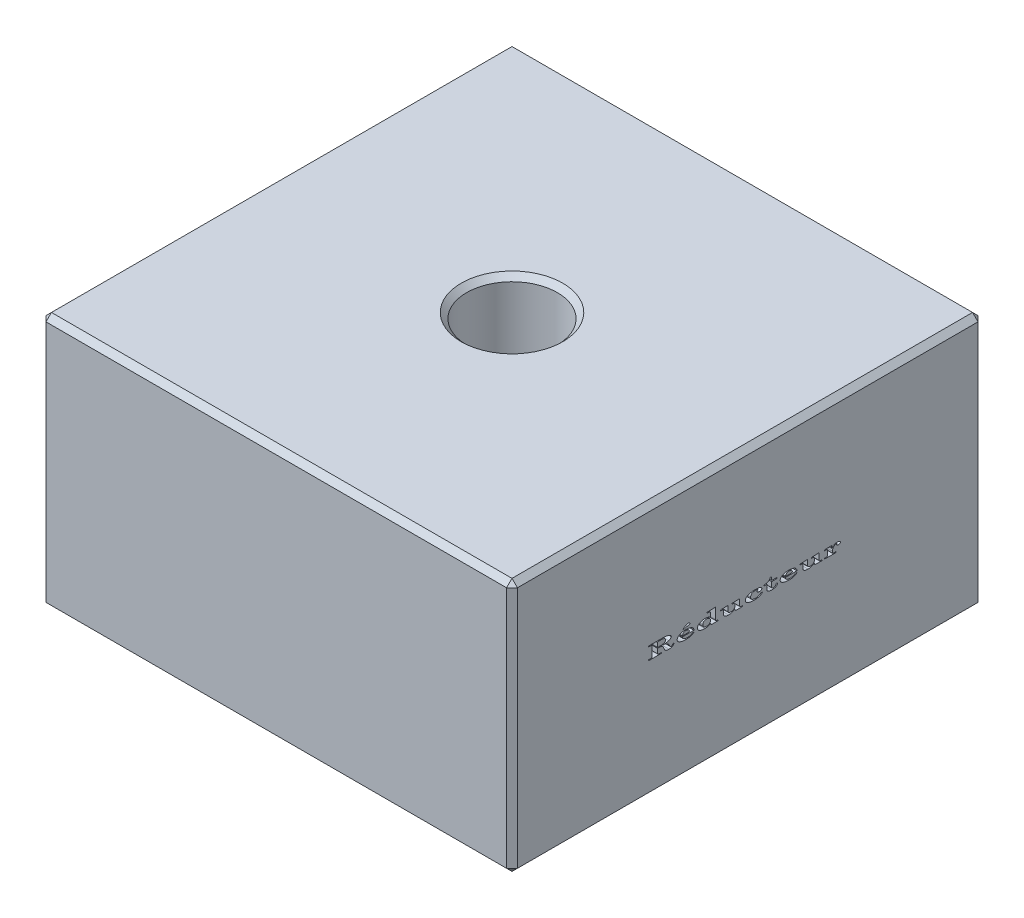
from build123d import *

# Parameters (mm, degrees)
ESQUISSE1_W             = 130
ESQUISSE1_H             = 130
ESQUISSE1_R             = 12.5
BOSS_EXTRU_1_DEPTH      = 70
CHANFREIN1_SIZE         = 1.5
ENL_V_MAT_EXTRU_1_DEPTH = 2


with BuildPart() as part:
    # Esquisse1 → Boss.-Extru.1 (new body)
    with BuildSketch(Plane(origin=(0, 0, 0), x_dir=(1, 0, 0), z_dir=(0, 1, 0))):
        with Locations((-65, 65)):
            Rectangle(ESQUISSE1_W, ESQUISSE1_H)
        with Locations(Location((-65, 65, 0), (0, 0, 270))):
            Circle(ESQUISSE1_R, mode=Mode.SUBTRACT)
    extrude(amount=BOSS_EXTRU_1_DEPTH)

    # Chanfrein1
    chanfrein1_edges = [part.edges().sort_by_distance(p)[0] for p in [
        (-65, 0, -77.5),
        (-65, 70, -77.5),
        (0, 70, -65),
        (-65, 70, -130),
        (-130, 70, -65),
        (-65, 0, -130),
        (0, 0, -65),
        (-65, 0, 0),
        (-130, 0, -65),
        (-130, 35, -130),
        (0, 35, -130),
        (0, 35, 0),
        (-130, 35, 0),
        (-65, 70, 0),
    ]]
    chamfer(chanfrein1_edges, length=CHANFREIN1_SIZE)

    # Esquisse2 → Enlèv. mat.-Extru.1 (cut)
    # profile 1 of 10: a face of its own
    with BuildSketch(Plane(origin=(0, 0, 0), x_dir=(0, 0, -1), z_dir=(1, 0, 0))):
        with BuildLine():
            Line((37.683124261, 36.492956048), (41.35069237, 36.492956048))
            add(Edge.make_bspline(
                [(41.35069237, 36.492956048), (41.423376937, 36.492435815), (41.565256509, 36.491420325), (41.773082977, 36.486903448), (41.970596284, 36.477647172), (42.157856433, 36.465226235), (42.334591198, 36.449114049), (42.501152908, 36.429904694), (42.657224341, 36.405741581), (42.803516838, 36.37961398), (42.939858773, 36.348907036), (43.067484737, 36.317150025), (43.186139016, 36.28221061), (43.295533585, 36.244291331), (43.396165879, 36.20463166), (43.487579822, 36.161944011), (43.570103325, 36.116333424), (43.643551913, 36.068079676), (43.708737596, 36.018206608), (43.76483423, 35.966547538), (43.812332924, 35.913358524), (43.852358591, 35.859469283), (43.882702299, 35.803189907), (43.903721884, 35.745488578), (43.918125516, 35.686903231), (43.919577487, 35.64701987), (43.920303748, 35.627070631)],
                knots=[0, 0, 0, 0, 1.803406573, 3.520232142, 5.157135887, 6.708840274, 8.176126967, 9.559920692, 10.867921294, 12.093964218, 13.246167546, 14.33467399, 15.356603101, 16.31382416, 17.206448863, 18.039109272, 18.815194361, 19.543727151, 20.217572676, 20.849472375, 21.432614653, 21.984688226, 22.511328061, 23.012182554, 23.505904074, 24, 24, 24, 24], degree=3))
            add(Edge.make_bspline(
                [(43.920303748, 35.627070631), (43.919796843, 35.611134682), (43.91879074, 35.579505038), (43.9096902, 35.532810344), (43.896714708, 35.487011854), (43.877296031, 35.442446597), (43.852794456, 35.398857026), (43.822298542, 35.356893953), (43.787115868, 35.31584528), (43.745910846, 35.276627016), (43.699737196, 35.237926299), (43.647475856, 35.201174406), (43.590586726, 35.164179447), (43.527531349, 35.12961104), (43.459283275, 35.096097118), (43.386116295, 35.062732998), (43.307138993, 35.031506487), (43.252202256, 35.012233542), (43.224089806, 35.002371112)],
                knots=[0, 0, 0, 0, 0.76683207, 1.522006948, 2.28436379, 3.055973676, 3.857471639, 4.688469069, 5.550530586, 6.458137834, 7.425299066, 8.449977353, 9.533564859, 10.692593611, 11.910952816, 13.195736886, 14.564991094, 16, 16, 16, 16], degree=3))
            add(Edge.make_bspline(
                [(43.224089806, 35.002371112), (43.177024725, 34.987388181), (43.077828063, 34.955809424), (42.918385194, 34.916375281), (42.741121029, 34.881844511), (42.546075385, 34.850502061), (42.333093671, 34.822568087), (42.102086059, 34.7990013), (41.853353582, 34.779344759), (41.681412694, 34.770145002), (41.592579389, 34.765391945)],
                knots=[0, 0, 0, 0, 0.716884242, 1.510940212, 2.382572195, 3.338025058, 4.378301861, 5.500451401, 6.708607549, 8, 8, 8, 8], degree=3))
            add(Edge.make_bspline(
                [(41.592579389, 34.765391945), (41.638173441, 34.761643497), (41.726647892, 34.754369701), (41.855165323, 34.740080182), (41.97577976, 34.724700974), (42.08834379, 34.70835106), (42.192544706, 34.689169405), (42.288646181, 34.668901864), (42.377013911, 34.647638067), (42.48286722, 34.615870265), (42.606417457, 34.570335231), (42.745596934, 34.50349081), (42.876522783, 34.425310101), (42.95593442, 34.363108505), (42.9955241, 34.332098676)],
                knots=[0, 0, 0, 0, 1.102707776, 2.139784928, 3.116648603, 4.03367121, 4.881196666, 5.670093997, 6.401088389, 7.071267056, 8.333281504, 9.570469844, 10.788788043, 12, 12, 12, 12], degree=3))
            add(Edge.make_bspline(
                [(42.9955241, 34.332098676), (43.042000135, 34.287617925), (43.135139791, 34.198476888), (43.258953608, 34.048735289), (43.370418804, 33.886743691), (43.432476241, 33.770445544), (43.463873459, 33.711605887)],
                knots=[0, 0, 0, 0, 0.986881488, 1.977746238, 2.976864887, 4, 4, 4, 4], degree=3))
            add(Edge.make_bspline(
                [(43.463873459, 33.711605887), (43.482008016, 33.675905189), (43.515702838, 33.609571685), (43.567024202, 33.520338019), (43.615527141, 33.448938689), (43.650232845, 33.410523702), (43.665796536, 33.393296593)],
                knots=[0, 0, 0, 0, 1.269850929, 2.359440203, 3.264294845, 4, 4, 4, 4], degree=3))
            add(Edge.make_bspline(
                [(43.665796536, 33.393296593), (43.680759229, 33.380045375), (43.709543376, 33.35455364), (43.7594763, 33.327335376), (43.811945141, 33.310431914), (43.848199337, 33.308182671), (43.86631737, 33.307058612)],
                knots=[0, 0, 0, 0, 1.069445198, 2.05732133, 3.029146416, 4, 4, 4, 4], degree=3))
            add(Edge.make_bspline(
                [(43.86631737, 33.307058612), (43.890765894, 33.308144762), (43.937895005, 33.31023852), (44.004794899, 33.329975005), (44.064267527, 33.361697551), (44.115130552, 33.407466992), (44.157576492, 33.465617631), (44.19169314, 33.536250195), (44.218362521, 33.619108144), (44.228861611, 33.679180045), (44.234406312, 33.710904766)],
                knots=[0, 0, 0, 0, 0.968222769, 1.866430792, 2.742136399, 3.622544868, 4.557498432, 5.582058266, 6.723054818, 8, 8, 8, 8], degree=3))
            Line((44.234406312, 33.710904766), (44.638252466, 33.710904766))
            add(Edge.make_bspline(
                [(44.638252466, 33.710904766), (44.633699157, 33.677788143), (44.624837974, 33.613339966), (44.598127728, 33.521489944), (44.563420492, 33.436711718), (44.518428773, 33.359458995), (44.465228361, 33.28856586), (44.401146794, 33.225998526), (44.328592202, 33.17013418), (44.246197721, 33.122556175), (44.155350596, 33.081381436), (44.055797632, 33.045838132), (43.947746199, 33.014672519), (43.830378409, 32.991009643), (43.704620744, 32.970819725), (43.569703542, 32.958376816), (43.426131829, 32.949501452), (43.32740372, 32.948565286), (43.27667394, 32.948084253)],
                knots=[0, 0, 0, 0, 0.925636545, 1.801378947, 2.643670301, 3.459376239, 4.273175777, 5.09327009, 5.934314528, 6.805515203, 7.724597842, 8.696083653, 9.733802265, 10.83933073, 12.013204389, 13.263280177, 14.593782513, 16, 16, 16, 16], degree=3))
            add(Edge.make_bspline(
                [(43.27667394, 32.948084253), (43.240213306, 32.948361355), (43.169369755, 32.94889977), (43.0657451, 32.952841615), (42.967847903, 32.96099971), (42.875112832, 32.970153748), (42.787931556, 32.983798774), (42.706207689, 32.999544509), (42.629943613, 33.018633487), (42.537676615, 33.046699122), (42.432595883, 33.089416455), (42.320452876, 33.152394518), (42.223358584, 33.225952762), (42.171743434, 33.285102191), (42.146465607, 33.31406983)],
                knots=[0, 0, 0, 0, 1.068954469, 2.076994353, 3.039189998, 3.948688258, 4.808215989, 5.625208688, 6.387967345, 7.111852932, 8.451655562, 9.703494892, 10.875317454, 12, 12, 12, 12], degree=3))
            add(Edge.make_bspline(
                [(42.146465607, 33.31406983), (42.138845412, 33.324017837), (42.121957073, 33.346065212), (42.097508348, 33.384948422), (42.072118768, 33.433002014), (42.043218069, 33.488910165), (42.01237657, 33.553685268), (41.979684575, 33.627202132), (41.944452156, 33.709406944), (41.921057517, 33.767414607), (41.908785318, 33.797843868)],
                knots=[0, 0, 0, 0, 0.55634834, 1.233012928, 2.036541127, 2.969605349, 4.028117026, 5.222172624, 6.542826454, 8, 8, 8, 8], degree=3))
            add(Edge.make_bspline(
                [(41.908785318, 33.797843868), (41.894512811, 33.833458489), (41.867042639, 33.902005644), (41.823911332, 33.99947251), (41.783002858, 34.088289015), (41.743116251, 34.167987158), (41.70381215, 34.23802672), (41.666231714, 34.299470862), (41.629156595, 34.351444005), (41.581486078, 34.408898568), (41.516186081, 34.469542594), (41.429767365, 34.532383596), (41.33226258, 34.584600127), (41.224167232, 34.626673949), (41.104136126, 34.658475548), (40.971992425, 34.682569599), (40.826259782, 34.695081819), (40.724844917, 34.697055789), (40.672006472, 34.698084253)],
                knots=[0, 0, 0, 0, 1.098647794, 2.114557956, 3.051761701, 3.898792814, 4.665848314, 5.351146269, 5.960320432, 6.492456216, 7.486662963, 8.502749468, 9.54484207, 10.64473262, 11.816932471, 13.095552934, 14.486745831, 16, 16, 16, 16], degree=3))
            Line((40.672006472, 34.698084253), (40.151072979, 34.698084253))
            Line((40.151072979, 34.698084253), (40.151072979, 33.406617907))
            add(Edge.make_bspline(
                [(40.151072979, 33.406617907), (40.152208336, 33.393029868), (40.1544617, 33.366061441), (40.175509595, 33.329451497), (40.207887324, 33.297935051), (40.236077805, 33.283838018), (40.251333395, 33.276209253)],
                knots=[0, 0, 0, 0, 0.928449039, 1.842709581, 2.832558461, 4, 4, 4, 4], degree=3))
            add(Edge.make_bspline(
                [(40.251333395, 33.276209253), (40.276156057, 33.266951457), (40.32682876, 33.248052696), (40.408458801, 33.230693971), (40.495443517, 33.218951341), (40.555576689, 33.217870365), (40.586469613, 33.217315022)],
                knots=[0, 0, 0, 0, 0.92754544, 1.893480841, 2.917793015, 4, 4, 4, 4], degree=3))
            Line((40.586469613, 33.217315022), (41.227996056, 33.217315022))
            Line((41.227996056, 33.217315022), (41.227996056, 32.992956048))
            Line((41.227996056, 32.992956048), (37.683124261, 32.992956048))
            Line((37.683124261, 32.992956048), (37.683124261, 33.217315022))
            Line((37.683124261, 33.217315022), (38.236309357, 33.217315022))
            add(Edge.make_bspline(
                [(38.236309357, 33.217315022), (38.270004683, 33.217855735), (38.333141525, 33.218868899), (38.421081585, 33.229564723), (38.496520726, 33.245091511), (38.558234409, 33.270026757), (38.608317611, 33.299448361), (38.644050255, 33.33677212), (38.666420379, 33.380388337), (38.668996424, 33.41174055), (38.670303748, 33.42765156)],
                knots=[0, 0, 0, 0, 1.519345433, 2.846883625, 3.992908673, 4.981747751, 5.839048337, 6.5924564, 7.285682287, 8, 8, 8, 8], degree=3))
            Line((38.670303748, 33.42765156), (38.670303748, 36.058260535))
            add(Edge.make_bspline(
                [(38.670303748, 36.058260535), (38.669238079, 36.075307677), (38.66717924, 36.108242226), (38.646854224, 36.153516014), (38.614761832, 36.191857), (38.568554898, 36.219946697), (38.512556942, 36.242111927), (38.445766954, 36.258056466), (38.368336036, 36.266459625), (38.313218995, 36.267856297), (38.283985639, 36.268597073)],
                knots=[0, 0, 0, 0, 0.827674399, 1.599041186, 2.376038156, 3.233440287, 4.205690717, 5.309551299, 6.573021251, 8, 8, 8, 8], degree=3))
            Line((38.283985639, 36.268597073), (37.683124261, 36.268597073))
            Line((37.683124261, 36.268597073), (37.683124261, 36.492956048))
        make_face()
        with BuildLine():
            Line((40.151072979, 34.922443227), (40.749830991, 34.922443227))
            add(Edge.make_bspline(
                [(40.749830991, 34.922443227), (40.814349724, 34.922814259), (40.939962032, 34.923536625), (41.123045887, 34.933948606), (41.295936067, 34.948906749), (41.458366549, 34.970324523), (41.610176631, 34.998486843), (41.751770873, 35.031753239), (41.882843991, 35.071836726), (41.965077379, 35.104882397), (42.004839004, 35.120860695)],
                knots=[0, 0, 0, 0, 1.210749494, 2.357222947, 3.440562319, 4.467231304, 5.430783553, 6.337223366, 7.196011459, 8, 8, 8, 8], degree=3))
            add(Edge.make_bspline(
                [(42.004839004, 35.120860695), (42.032098126, 35.133960026), (42.084861272, 35.159315279), (42.155537853, 35.2075951), (42.21603682, 35.261623658), (42.265271359, 35.322984982), (42.303615496, 35.390897751), (42.330129575, 35.465650182), (42.346737992, 35.546648977), (42.348751076, 35.602914642), (42.349790927, 35.631978484)],
                knots=[0, 0, 0, 0, 1.102952523, 2.134890675, 3.113590473, 4.054469501, 4.994380606, 5.947256615, 6.939662239, 8, 8, 8, 8], degree=3))
            add(Edge.make_bspline(
                [(42.349790927, 35.631978484), (42.348643753, 35.658689384), (42.346409849, 35.710703792), (42.331019822, 35.786142077), (42.303782871, 35.855790472), (42.266520729, 35.920160918), (42.217886763, 35.978645028), (42.158009037, 36.030223034), (42.088882555, 36.077973116), (42.00740079, 36.118374902), (41.9134013, 36.154638191), (41.804258023, 36.184584517), (41.679982851, 36.211126948), (41.540241915, 36.232673897), (41.385034545, 36.24811446), (41.214348006, 36.259827937), (41.028019245, 36.267903236), (40.898477994, 36.268359811), (40.83116112, 36.268597073)],
                knots=[0, 0, 0, 0, 0.702412992, 1.36781599, 2.013861005, 2.661132856, 3.31589055, 4.003958201, 4.733621787, 5.519784781, 6.38956036, 7.379894284, 8.492596739, 9.730482671, 11.096173871, 12.593400006, 14.229740247, 16, 16, 16, 16], degree=3))
            add(Edge.make_bspline(
                [(40.83116112, 36.268597073), (40.79540442, 36.268444121), (40.727389648, 36.268153182), (40.630587825, 36.266491676), (40.544383079, 36.261772127), (40.468306551, 36.257629959), (40.402910767, 36.250260871), (40.347528744, 36.243168724), (40.302917565, 36.233662939), (40.25803294, 36.219526081), (40.213520737, 36.192431076), (40.175717255, 36.143378794), (40.153996608, 36.079566754), (40.152098265, 36.032499473), (40.151072979, 36.007078644)],
                knots=[0, 0, 0, 0, 1.555746318, 2.959270045, 4.211428477, 5.311883119, 6.273074029, 7.074030598, 7.740174309, 8.254641943, 9.117969468, 9.958050574, 10.897152196, 12, 12, 12, 12], degree=3))
            Line((40.151072979, 36.007078644), (40.151072979, 34.922443227))
        make_face(mode=Mode.SUBTRACT)
    # profile 2 of 10: a face of its own
    with BuildSketch(Plane(origin=(0, 0, 0), x_dir=(0, 0, -1), z_dir=(1, 0, 0))):
        with BuildLine():
            Line((50.157483235, 34.02500733), (47.016457594, 34.02500733))
            add(Edge.make_bspline(
                [(47.016457594, 34.02500733), (47.018673446, 33.989624154), (47.022976695, 33.920909006), (47.042973195, 33.821483871), (47.073683062, 33.729302969), (47.115436928, 33.64402268), (47.168318237, 33.566112749), (47.233326985, 33.496402348), (47.307812863, 33.43281531), (47.393364837, 33.377705557), (47.487291259, 33.329990899), (47.587828405, 33.287786935), (47.694744543, 33.252178292), (47.808026493, 33.222473706), (47.927853793, 33.200556234), (48.053996922, 33.184420857), (48.186472047, 33.17450995), (48.277057359, 33.173142187), (48.32334862, 33.172443227)],
                knots=[0, 0, 0, 0, 0.973110879, 1.889809411, 2.777096994, 3.635670993, 4.490491539, 5.353877659, 6.246700206, 7.174529063, 8.142266004, 9.137970209, 10.167385546, 11.235712275, 12.352709693, 13.511462261, 14.728297723, 16, 16, 16, 16], degree=3))
            add(Edge.make_bspline(
                [(48.32334862, 33.172443227), (48.390464177, 33.173897777), (48.523112451, 33.176772573), (48.719358621, 33.196398188), (48.909865898, 33.230688632), (49.065352034, 33.268526437), (49.187708376, 33.308025018), (49.279816305, 33.343083232), (49.372782335, 33.383130118), (49.466050306, 33.428903284), (49.560007715, 33.479884871), (49.653932415, 33.537396893), (49.749496929, 33.598429409), (49.811802717, 33.6432944), (49.843380671, 33.666032971)],
                knots=[0, 0, 0, 0, 1.484019585, 2.933040311, 4.355274954, 5.761525371, 6.467512253, 7.196940428, 7.939952758, 8.704941593, 9.493497318, 10.302645256, 11.139743024, 12, 12, 12, 12], degree=3))
            Line((49.843380671, 33.666032971), (50.20235503, 33.576289381))
            add(Edge.make_bspline(
                [(50.20235503, 33.576289381), (50.16802036, 33.547001305), (50.099684193, 33.488709357), (49.993001291, 33.407035774), (49.882068873, 33.33246545), (49.766751699, 33.265678025), (49.648759702, 33.203353896), (49.526824351, 33.148005855), (49.400983733, 33.099708301), (49.271102005, 33.05735297), (49.135776584, 33.020926167), (48.993993445, 32.989472475), (48.844997019, 32.962778959), (48.688688043, 32.94154777), (48.525096925, 32.923471219), (48.354078301, 32.91240234), (48.175964086, 32.903939701), (48.054830092, 32.903457903), (47.993120254, 32.903212458)],
                knots=[0, 0, 0, 0, 0.91553949, 1.822194829, 2.724375286, 3.625458502, 4.524743347, 5.430865349, 6.34051643, 7.25821452, 8.201430564, 9.182744795, 10.204018039, 11.271597661, 12.382768075, 13.542561075, 14.748095803, 16, 16, 16, 16], degree=3))
            add(Edge.make_bspline(
                [(47.993120254, 32.903212458), (47.90358784, 32.904059816), (47.728823527, 32.905713831), (47.473338043, 32.921332312), (47.231202535, 32.947120526), (47.001995337, 32.982525611), (46.785817985, 33.028483961), (46.582797328, 33.085231544), (46.392694445, 33.151800245), (46.2438401, 33.215984011), (46.133374616, 33.273198508), (46.05584361, 33.315451627), (45.984409227, 33.360464919), (45.918234455, 33.406861895), (45.857106715, 33.45455288), (45.800958139, 33.50348856), (45.749965065, 33.553988258), (45.705438044, 33.606829979), (45.665012721, 33.660022166), (45.630252798, 33.715019515), (45.601860651, 33.771888464), (45.577550728, 33.829859624), (45.558703507, 33.889201658), (45.545156214, 33.950181389), (45.537473206, 34.012656513), (45.536286398, 34.054901759), (45.535688363, 34.076189221)],
                knots=[0, 0, 0, 0, 2.170659912, 4.237056387, 6.203234737, 8.073006346, 9.857931867, 11.558678022, 13.180595348, 14.738686548, 15.48377087, 16.196521243, 16.87886699, 17.529709347, 18.155423207, 18.757788179, 19.334777775, 19.893474287, 20.431798722, 20.953769765, 21.46821221, 21.971230292, 22.476604741, 22.975681543, 23.483843937, 24, 24, 24, 24], degree=3))
            add(Edge.make_bspline(
                [(45.535688363, 34.076189221), (45.53628151, 34.097477721), (45.537458616, 34.139725028), (45.545241265, 34.202411892), (45.55860079, 34.26366629), (45.577603441, 34.323524123), (45.602349072, 34.381792345), (45.63215043, 34.438816665), (45.666308128, 34.495337931), (45.707103909, 34.54967086), (45.753256708, 34.602389068), (45.803657293, 34.654797782), (45.860642121, 34.704793378), (45.922437162, 34.753887522), (45.989315399, 34.802076034), (46.062346238, 34.847442377), (46.139433732, 34.893971371), (46.251748608, 34.951332396), (46.399045403, 35.019903961), (46.585822565, 35.09019666), (46.782435387, 35.148356636), (46.988453841, 35.197995349), (47.204409047, 35.235451543), (47.430064128, 35.261711863), (47.665216961, 35.278209778), (47.82529075, 35.28033456), (47.906882273, 35.281417586)],
                knots=[0, 0, 0, 0, 0.529112122, 1.050029925, 1.567307629, 2.085367507, 2.608612002, 3.138616172, 3.683561805, 4.248182911, 4.824690835, 5.424434637, 6.053960644, 6.707135427, 7.385772503, 8.101270765, 8.843458479, 9.622900344, 11.234360959, 12.879649333, 14.577730503, 16.327609788, 18.144012671, 20.0216605, 21.972192792, 24, 24, 24, 24], degree=3))
            add(Edge.make_bspline(
                [(47.906882273, 35.281417586), (47.96344919, 35.28111751), (48.074525244, 35.280528275), (48.238140758, 35.272819116), (48.395787962, 35.262925898), (48.547362758, 35.247618183), (48.692671798, 35.226810436), (48.832255681, 35.203653881), (48.965500908, 35.174672496), (49.092573346, 35.141898126), (49.213290737, 35.104703306), (49.32747801, 35.063829708), (49.434345673, 35.017690751), (49.535132056, 34.969218771), (49.628196247, 34.914881791), (49.714957235, 34.857532415), (49.794468581, 34.795700039), (49.866906204, 34.729596627), (49.932621253, 34.659620797), (49.989973465, 34.584100945), (50.038262561, 34.502942868), (50.079247722, 34.417173468), (50.111605657, 34.326224164), (50.135094883, 34.230336371), (50.15185058, 34.129543637), (50.155578159, 34.060363593), (50.157483235, 34.02500733)],
                knots=[0, 0, 0, 0, 1.421719756, 2.791720495, 4.116399774, 5.391839833, 6.619720854, 7.805670826, 8.947502244, 10.046035175, 11.103317202, 12.121644774, 13.092774246, 14.02806293, 14.930853104, 15.799255068, 16.640611181, 17.459772125, 18.261991301, 19.050346835, 19.838176916, 20.631724366, 21.436263092, 22.259772646, 23.110611482, 24, 24, 24, 24], degree=3))
        make_face()
        with BuildLine():
            Line((47.016457594, 34.249366304), (48.509847017, 34.249366304))
            add(Edge.make_bspline(
                [(48.509847017, 34.249366304), (48.542345135, 34.250095685), (48.602580564, 34.251447596), (48.685698441, 34.259576425), (48.753899701, 34.275406777), (48.809366001, 34.297198142), (48.851627764, 34.330201727), (48.881861615, 34.37370385), (48.898331557, 34.428207311), (48.900121505, 34.46754063), (48.901072979, 34.488448836)],
                knots=[0, 0, 0, 0, 1.482367288, 2.747575369, 3.799661154, 4.668698415, 5.442679405, 6.208398066, 7.047647576, 8, 8, 8, 8], degree=3))
            add(Edge.make_bspline(
                [(48.901072979, 34.488448836), (48.900245647, 34.510472558), (48.89862245, 34.553682405), (48.88644386, 34.616433524), (48.8667977, 34.675224859), (48.839089041, 34.730145218), (48.802769887, 34.780796825), (48.759089108, 34.828056981), (48.707091375, 34.871166291), (48.647713481, 34.909750459), (48.582721687, 34.944634781), (48.512883443, 34.975043337), (48.438554925, 34.99973473), (48.360272758, 35.021275206), (48.277441982, 35.036897503), (48.190199308, 35.049019053), (48.098638262, 35.056024743), (48.036133999, 35.056710015), (48.004338203, 35.057058612)],
                knots=[0, 0, 0, 0, 0.892599322, 1.751251676, 2.581347799, 3.399292461, 4.235424942, 5.100485433, 6.001994452, 6.966593042, 7.96720052, 8.990042982, 10.050897864, 11.140525071, 12.279790156, 13.465861971, 14.71088895, 16, 16, 16, 16], degree=3))
            add(Edge.make_bspline(
                [(48.004338203, 35.057058612), (47.966916538, 35.056693527), (47.894037787, 35.055982524), (47.788265403, 35.045495274), (47.688936837, 35.030917263), (47.596932481, 35.008126943), (47.511435631, 34.980209002), (47.432360089, 34.946185578), (47.360673416, 34.904238356), (47.29490245, 34.85739517), (47.235960089, 34.803735669), (47.18504522, 34.742820534), (47.139224833, 34.676605765), (47.102171951, 34.602991686), (47.06889163, 34.524250135), (47.045227778, 34.438087688), (47.026602091, 34.346021359), (47.019899896, 34.282163975), (47.016457594, 34.249366304)],
                knots=[0, 0, 0, 0, 1.249029953, 2.432487787, 3.546165179, 4.598548239, 5.593091272, 6.547128135, 7.46670945, 8.361212498, 9.239465804, 10.119796999, 11.007259567, 11.921760375, 12.866656746, 13.85714992, 14.899414796, 16, 16, 16, 16], degree=3))
        make_face(mode=Mode.SUBTRACT)
    # profile 3 of 10: a face of its own
    with BuildSketch(Plane(origin=(0, 0, 0), x_dir=(0, 0, -1), z_dir=(1, 0, 0))):
        with BuildLine():
            Line((47.193140286, 35.640391945), (47.061329389, 35.694378323))
            Line((47.061329389, 35.694378323), (47.824851023, 36.235644349))
            add(Edge.make_bspline(
                [(47.824851023, 36.235644349), (47.85499293, 36.256114497), (47.914157397, 36.296294616), (48.005706595, 36.349339333), (48.098166328, 36.393427005), (48.191249318, 36.429442404), (48.284770541, 36.457604324), (48.378948204, 36.47816591), (48.474003877, 36.490337876), (48.537624387, 36.492083182), (48.56944237, 36.492956048)],
                knots=[0, 0, 0, 0, 1.092003681, 2.143454862, 3.168145005, 4.159531447, 5.1325286, 6.093036594, 7.046286657, 8, 8, 8, 8], degree=3))
            add(Edge.make_bspline(
                [(48.56944237, 36.492956048), (48.603851228, 36.49204024), (48.671590776, 36.490237322), (48.770561634, 36.475230897), (48.864694344, 36.45074524), (48.950726622, 36.417090758), (49.024713654, 36.37924321), (49.07998406, 36.339153274), (49.118095832, 36.296813258), (49.123132924, 36.264441773), (49.125431953, 36.249666785)],
                knots=[0, 0, 0, 0, 1.281671177, 2.523182448, 3.720913022, 4.898301819, 5.961832326, 6.801380095, 7.452926115, 8, 8, 8, 8], degree=3))
            add(Edge.make_bspline(
                [(49.125431953, 36.249666785), (49.123902505, 36.23418453), (49.120764034, 36.202414496), (49.094846984, 36.157731636), (49.053908188, 36.11775759), (49.008637786, 36.087608616), (48.962172602, 36.063974256), (48.915978923, 36.045676784), (48.860014375, 36.02604218), (48.794676016, 36.00500276), (48.719121715, 35.984481744), (48.634307287, 35.961463138), (48.539103431, 35.939803063), (48.472451553, 35.924584414), (48.437631472, 35.916633932)],
                knots=[0, 0, 0, 0, 0.688288991, 1.412388913, 2.246658503, 3.231236461, 3.828910213, 4.573421765, 5.448504523, 6.47869195, 7.638915984, 8.945661932, 10.40436155, 12, 12, 12, 12], degree=3))
            Line((48.437631472, 35.916633932), (47.193140286, 35.640391945))
        make_face()
    # profile 4 of 10: a face of its own
    with BuildSketch(Plane(origin=(0, 0, 0), x_dir=(0, 0, -1), z_dir=(1, 0, 0))):
        with BuildLine():
            Line((53.747226825, 36.492956048), (56.080560158, 36.582699637))
            Line((56.080560158, 36.582699637), (56.080560158, 33.665331849))
            add(Edge.make_bspline(
                [(56.080560158, 33.665331849), (56.081065706, 33.631180824), (56.081993635, 33.568496908), (56.092404974, 33.483360252), (56.110518369, 33.415819082), (56.13684778, 33.363807862), (56.173740267, 33.326370729), (56.216079659, 33.295226796), (56.266848941, 33.270397299), (56.314577077, 33.252879337), (56.359666637, 33.243250127), (56.401306462, 33.236293081), (56.450169617, 33.230018497), (56.506077226, 33.225257211), (56.568986852, 33.222007002), (56.639094395, 33.218986661), (56.716474781, 33.217900707), (56.770464163, 33.217515248), (56.798508876, 33.217315022)],
                knots=[0, 0, 0, 0, 1.627194198, 2.986701088, 4.076068781, 4.948160658, 5.728262871, 6.557025281, 7.443719461, 8.412524681, 8.971901604, 9.638453801, 10.424576389, 11.319071956, 12.311973725, 13.42672804, 14.663317294, 16, 16, 16, 16], degree=3))
            Line((56.798508876, 33.217315022), (56.798508876, 32.992956048))
            Line((56.798508876, 32.992956048), (54.913893491, 32.964911176))
            Line((54.913893491, 32.964911176), (54.779278107, 33.335804605))
            add(Edge.make_bspline(
                [(54.779278107, 33.335804605), (54.745296433, 33.31477149), (54.678652918, 33.273522175), (54.57844239, 33.216910096), (54.48080103, 33.165756708), (54.386158691, 33.119073375), (54.293532609, 33.078349879), (54.203230977, 33.043252739), (54.115208057, 33.013728079), (54.028484976, 32.988638081), (53.940179351, 32.968252323), (53.848035175, 32.950690652), (53.750727142, 32.936052611), (53.648256502, 32.924502585), (53.540786731, 32.914149731), (53.427791218, 32.908538408), (53.309531142, 32.903902638), (53.228869411, 32.903445566), (53.187731632, 32.903212458)],
                knots=[0, 0, 0, 0, 1.143633695, 2.242849163, 3.292945155, 4.298005468, 5.262338166, 6.187681393, 7.069659576, 7.918556245, 8.770293802, 9.66228318, 10.602517255, 11.585617205, 12.613213527, 13.69172288, 14.822770204, 16, 16, 16, 16], degree=3))
            add(Edge.make_bspline(
                [(53.187731632, 32.903212458), (53.114092815, 32.904180669), (52.970183461, 32.906072806), (52.75954589, 32.920063692), (52.559484689, 32.943881457), (52.369735686, 32.976399184), (52.190321037, 33.019181253), (52.021349082, 33.071463664), (51.862801256, 33.133507304), (51.715502725, 33.203230582), (51.582317551, 33.281897866), (51.465587208, 33.36821502), (51.366474639, 33.461584103), (51.285297872, 33.562166735), (51.221733114, 33.669677869), (51.177564021, 33.784645977), (51.149748869, 33.906134395), (51.146377938, 33.989566286), (51.144662722, 34.032018548)],
                knots=[0, 0, 0, 0, 1.371540883, 2.680346687, 3.929755389, 5.122745894, 6.264085042, 7.362790205, 8.414466594, 9.432757764, 10.395051642, 11.290907655, 12.131492132, 12.924172784, 13.690910615, 14.447548221, 15.210073175, 16, 16, 16, 16], degree=3))
            add(Edge.make_bspline(
                [(51.144662722, 34.032018548), (51.146260732, 34.078914869), (51.149399059, 34.171014465), (51.178799368, 34.305093782), (51.224972594, 34.431966279), (51.291176756, 34.551042757), (51.376662894, 34.661799916), (51.479920652, 34.765305372), (51.60170939, 34.861112385), (51.741177861, 34.947402983), (51.893332423, 35.025949131), (52.056478554, 35.09402589), (52.228206354, 35.152035809), (52.4089569, 35.200011975), (52.598863792, 35.235803458), (52.797266633, 35.262710397), (53.004966803, 35.277969458), (53.146341381, 35.280251505), (53.218580991, 35.281417586)],
                knots=[0, 0, 0, 0, 0.838937684, 1.647588127, 2.446165475, 3.249947759, 4.077107048, 4.944347135, 5.862185956, 6.845870815, 7.877410246, 8.926131952, 10.008918094, 11.121702309, 12.272652633, 13.467881033, 14.706137353, 16, 16, 16, 16], degree=3))
            add(Edge.make_bspline(
                [(53.218580991, 35.281417586), (53.29550607, 35.279987064), (53.445175212, 35.27720377), (53.663223382, 35.25809859), (53.867887066, 35.223348029), (54.060879605, 35.176744793), (54.243803153, 35.115115203), (54.416481727, 35.035139069), (54.581684611, 34.939875233), (54.683258434, 34.863464305), (54.734406312, 34.824987298)],
                knots=[0, 0, 0, 0, 1.143208616, 2.224281811, 3.249209595, 4.22552937, 5.17230453, 6.112539966, 7.04956245, 8, 8, 8, 8], degree=3))
            Line((54.734406312, 34.824987298), (54.734406312, 35.861946432))
            add(Edge.make_bspline(
                [(54.734406312, 35.861946432), (54.733708678, 35.890738712), (54.732413116, 35.944208281), (54.720430805, 36.018163413), (54.699104475, 36.07903678), (54.668569208, 36.127804347), (54.63001635, 36.164868567), (54.587311022, 36.196927113), (54.537845602, 36.22081494), (54.492062485, 36.236589021), (54.449464843, 36.245543731), (54.409431219, 36.251645146), (54.361981744, 36.257317424), (54.306986578, 36.261142172), (54.244597952, 36.264890237), (54.174450103, 36.266617262), (54.09685909, 36.268104452), (54.042633792, 36.268428221), (54.014354229, 36.268597073)],
                knots=[0, 0, 0, 0, 1.428840845, 2.653471833, 3.703252377, 4.610944069, 5.480612122, 6.343910033, 7.251972438, 8.194945009, 8.741139766, 9.410692466, 10.205123957, 11.112815649, 12.147092798, 13.307894386, 14.596013763, 16, 16, 16, 16], degree=3))
            Line((54.014354229, 36.268597073), (53.747226825, 36.268597073))
            Line((53.747226825, 36.268597073), (53.747226825, 36.492956048))
        make_face()
        with BuildLine():
            add(Edge.make_bspline(
                [(53.660287722, 34.967315022), (53.616318842, 34.966819265), (53.53101065, 34.9658574), (53.407368621, 34.953398837), (53.292306853, 34.934816082), (53.185501491, 34.909380086), (53.087791414, 34.874690735), (52.998209814, 34.833610333), (52.917063241, 34.78459635), (52.86966696, 34.744974396), (52.846285318, 34.725428003)],
                knots=[0, 0, 0, 0, 1.215286777, 2.357893035, 3.43192826, 4.436557252, 5.388952647, 6.293864295, 7.15832522, 8, 8, 8, 8], degree=3))
            add(Edge.make_bspline(
                [(52.846285318, 34.725428003), (52.828446703, 34.708391491), (52.792458035, 34.674021034), (52.74791037, 34.612728646), (52.709687246, 34.544997939), (52.679163407, 34.469920246), (52.654104559, 34.388167422), (52.638205818, 34.298697069), (52.627162014, 34.202199415), (52.626022281, 34.135352205), (52.625431953, 34.100728484)],
                knots=[0, 0, 0, 0, 0.865574481, 1.746260701, 2.651137792, 3.594002225, 4.58941042, 5.651219983, 6.783442036, 8, 8, 8, 8], degree=3))
            add(Edge.make_bspline(
                [(52.625431953, 34.100728484), (52.625853783, 34.071970447), (52.626674264, 34.016034672), (52.632461861, 33.935103514), (52.640795866, 33.85950512), (52.655625398, 33.790002789), (52.671507228, 33.725409492), (52.692953606, 33.666937868), (52.71715435, 33.61375098), (52.755878376, 33.551228681), (52.813436524, 33.481396222), (52.896254681, 33.410113368), (52.9912172, 33.34910559), (53.098987922, 33.300727073), (53.216919977, 33.263090269), (53.343625175, 33.236968691), (53.478029453, 33.220463689), (53.570260704, 33.218381777), (53.617519293, 33.217315022)],
                knots=[0, 0, 0, 0, 0.902294893, 1.755007324, 2.54546739, 3.286155926, 3.983421886, 4.630646612, 5.237605862, 5.813651418, 6.93386166, 8.061822659, 9.229493302, 10.463383496, 11.757500527, 13.106634541, 14.517461635, 16, 16, 16, 16], degree=3))
            add(Edge.make_bspline(
                [(53.617519293, 33.217315022), (53.656564407, 33.218080401), (53.732658635, 33.219572033), (53.843950016, 33.228493538), (53.949449961, 33.244421034), (54.048900111, 33.267749703), (54.142799767, 33.296325877), (54.230883554, 33.331424689), (54.313299905, 33.373114585), (54.363817956, 33.406812035), (54.388753267, 33.42344483)],
                knots=[0, 0, 0, 0, 1.155628531, 2.252180916, 3.301831516, 4.310195533, 5.272853543, 6.20406053, 7.113538441, 8, 8, 8, 8], degree=3))
            add(Edge.make_bspline(
                [(54.388753267, 33.42344483), (54.4198704, 33.446186205), (54.480241015, 33.490306941), (54.560208049, 33.56518657), (54.627383079, 33.645220902), (54.683516715, 33.729505504), (54.726605739, 33.819219004), (54.756835699, 33.913602222), (54.775675945, 34.012574498), (54.778063972, 34.080311616), (54.779278107, 34.114750919)],
                knots=[0, 0, 0, 0, 1.116026498, 2.165212489, 3.164913432, 4.137810726, 5.091884337, 6.038430242, 7.002687174, 8, 8, 8, 8], degree=3))
            add(Edge.make_bspline(
                [(54.779278107, 34.114750919), (54.778135675, 34.14659602), (54.775904131, 34.20879998), (54.760279771, 34.299840865), (54.733640499, 34.385650568), (54.696026557, 34.466466398), (54.647876452, 34.542068499), (54.589090509, 34.612588725), (54.51978209, 34.678063936), (54.440881683, 34.737607136), (54.355150395, 34.790952108), (54.265340035, 34.837961969), (54.1723479, 34.878178179), (54.076293047, 34.911159344), (53.976899587, 34.936676202), (53.874098081, 34.953573362), (53.768309735, 34.965602227), (53.69654721, 34.966740092), (53.660287722, 34.967315022)],
                knots=[0, 0, 0, 0, 0.976492022, 1.907410198, 2.823306298, 3.724414543, 4.633130567, 5.564628041, 6.533010336, 7.550848725, 8.590980285, 9.626532854, 10.657112275, 11.695266209, 12.738332552, 13.800047476, 14.888428882, 16, 16, 16, 16], degree=3))
        make_face(mode=Mode.SUBTRACT)
    # profile 5 of 10: a face of its own
    with BuildSketch(Plane(origin=(0, 0, 0), x_dir=(0, 0, -1), z_dir=(1, 0, 0))):
        with BuildLine():
            Line((57.561329389, 35.191673996), (59.580560158, 35.281417586))
            Line((59.580560158, 35.281417586), (59.580560158, 33.764190022))
            add(Edge.make_bspline(
                [(59.580560158, 33.764190022), (59.581159113, 33.746825751), (59.582328297, 33.712929995), (59.593734043, 33.663779734), (59.609876207, 33.616924262), (59.635555205, 33.573895227), (59.666363855, 33.532760173), (59.704528685, 33.494961694), (59.749670393, 33.46021333), (59.801157288, 33.428347054), (59.858458485, 33.400163199), (59.919646788, 33.374586066), (59.985313202, 33.353493782), (60.055062744, 33.337199985), (60.128744735, 33.323658007), (60.20643929, 33.313863761), (60.28838091, 33.308410697), (60.344307735, 33.307515248), (60.372827786, 33.307058612)],
                knots=[0, 0, 0, 0, 0.821386548, 1.603379611, 2.381126527, 3.159976518, 3.966217182, 4.811954552, 5.69584101, 6.660791127, 7.676094017, 8.718810247, 9.801005714, 10.939910674, 12.11072867, 13.349744599, 14.648494373, 16, 16, 16, 16], degree=3))
            add(Edge.make_bspline(
                [(60.372827786, 33.307058612), (60.413284197, 33.307431242), (60.492221552, 33.308158306), (60.607340669, 33.318620668), (60.716313388, 33.333530256), (60.818962006, 33.355256323), (60.915383098, 33.383153605), (61.00561408, 33.417736199), (61.089941525, 33.457964024), (61.166839383, 33.50532399), (61.236498271, 33.555682661), (61.297273728, 33.609262771), (61.349187227, 33.664833816), (61.391410049, 33.722976554), (61.424268494, 33.783311229), (61.447720146, 33.845795248), (61.462185751, 33.910535029), (61.464178553, 33.954589606), (61.465175543, 33.976629926)],
                knots=[0, 0, 0, 0, 1.375490563, 2.683816617, 3.928211602, 5.114591581, 6.249028392, 7.338462721, 8.39787704, 9.421654492, 10.40578426, 11.318049899, 12.173042066, 12.98711347, 13.755345026, 14.502394856, 15.250754449, 16, 16, 16, 16], degree=3))
            Line((61.465175543, 33.976629926), (61.465175543, 34.705095471))
            add(Edge.make_bspline(
                [(61.465175543, 34.705095471), (61.463513807, 34.725538677), (61.460220037, 34.76605971), (61.430456033, 34.82166423), (61.382920869, 34.868187155), (61.317716913, 34.903853373), (61.238677559, 34.933413596), (61.145478084, 34.952401889), (61.039494745, 34.96539617), (60.964388661, 34.96665063), (60.924610639, 34.967315022)],
                knots=[0, 0, 0, 0, 0.736965, 1.460758318, 2.2276559, 3.119950304, 4.133469228, 5.278592484, 6.558675914, 8, 8, 8, 8], degree=3))
            Line((60.924610639, 34.967315022), (60.70235503, 34.967315022))
            Line((60.70235503, 34.967315022), (60.70235503, 35.191673996))
            Line((60.70235503, 35.191673996), (62.766457594, 35.281417586))
            Line((62.766457594, 35.281417586), (62.766457594, 33.476730086))
            add(Edge.make_bspline(
                [(62.766457594, 33.476730086), (62.768352529, 33.457179574), (62.772123686, 33.418271619), (62.803611305, 33.364600208), (62.853381933, 33.319356504), (62.921094329, 33.28265985), (63.003113134, 33.252894646), (63.098732225, 33.232888456), (63.206130976, 33.219140361), (63.281965874, 33.217943074), (63.321746056, 33.217315022)],
                knots=[0, 0, 0, 0, 0.696534649, 1.386190775, 2.168084847, 3.083061531, 4.126789297, 5.284740878, 6.575675561, 8, 8, 8, 8], degree=3))
            Line((63.321746056, 33.217315022), (63.529278107, 33.217315022))
            Line((63.529278107, 33.217315022), (63.529278107, 32.992956048))
            Line((63.529278107, 32.992956048), (61.644662722, 32.992956048))
            add(Edge.make_bspline(
                [(61.644662722, 32.992956048), (61.626486939, 33.027621146), (61.59040208, 33.096442677), (61.551919553, 33.206579278), (61.522658629, 33.319321511), (61.514255868, 33.396639239), (61.510047338, 33.4353639)],
                knots=[0, 0, 0, 0, 1.006953621, 1.999131492, 2.997863028, 4, 4, 4, 4], degree=3))
            add(Edge.make_bspline(
                [(61.510047338, 33.4353639), (61.471864086, 33.411521946), (61.396649219, 33.364557127), (61.282848269, 33.299147445), (61.169842797, 33.239875939), (61.058574686, 33.184547115), (60.947368817, 33.136401503), (60.837429728, 33.093027661), (60.728976159, 33.053968822), (60.585314708, 33.011321081), (60.404281372, 32.967820306), (60.183351867, 32.930986859), (59.958261471, 32.907708894), (59.806844899, 32.904718333), (59.730600222, 32.903212458)],
                knots=[0, 0, 0, 0, 0.859853454, 1.69377309, 2.506548598, 3.297186611, 4.066876846, 4.820447772, 5.554688853, 6.267932514, 7.682071493, 9.108097682, 10.543804326, 12, 12, 12, 12], degree=3))
            add(Edge.make_bspline(
                [(59.730600222, 32.903212458), (59.693198625, 32.903377224), (59.619997134, 32.903699701), (59.512498732, 32.909288081), (59.409535807, 32.915569555), (59.311146031, 32.926493951), (59.217013725, 32.939330405), (59.127607568, 32.956606088), (59.04242994, 32.974892038), (58.96235123, 32.997787678), (58.885958404, 33.02261827), (58.814160187, 33.052415177), (58.745516102, 33.084199807), (58.681876271, 33.121247227), (58.62127217, 33.160165459), (58.564733993, 33.20326288), (58.512498925, 33.250177729), (58.46378493, 33.299910106), (58.420187583, 33.352904132), (58.383105737, 33.409677881), (58.350330701, 33.468377101), (58.324770659, 33.53043653), (58.303714399, 33.594749047), (58.29055298, 33.662138422), (58.280512496, 33.732108503), (58.279695217, 33.779809229), (58.279278107, 33.804153964)],
                knots=[0, 0, 0, 0, 1.405630667, 2.751065927, 4.0453727, 5.282242291, 6.471139991, 7.615151091, 8.704217212, 9.744356069, 10.744401696, 11.721537262, 12.66459391, 13.585292218, 14.486806766, 15.370555952, 16.253999471, 17.123709871, 17.985308205, 18.828300394, 19.669597388, 20.508184145, 21.347184893, 22.208604082, 23.085735957, 24, 24, 24, 24], degree=3))
            Line((58.279278107, 33.804153964), (58.279278107, 34.691073035))
            add(Edge.make_bspline(
                [(58.279278107, 34.691073035), (58.278964247, 34.702799002), (58.278355422, 34.725545011), (58.271004935, 34.7584389), (58.25919704, 34.788883284), (58.242032948, 34.816427453), (58.22050494, 34.841458026), (58.194370109, 34.864035189), (58.163251623, 34.883480458), (58.127278003, 34.900653049), (58.084705271, 34.915462255), (58.034527979, 34.92846358), (57.975969048, 34.939600255), (57.909212516, 34.948293038), (57.834192325, 34.956199894), (57.750675679, 34.961340923), (57.658829047, 34.965844813), (57.594755827, 34.966810981), (57.561329389, 34.967315022)],
                knots=[0, 0, 0, 0, 0.66216402, 1.284464487, 1.895714806, 2.501075841, 3.110464989, 3.757140772, 4.446585889, 5.179762183, 6.007645332, 6.992032681, 8.109452487, 9.377009488, 10.798951638, 12.37562375, 14.109194593, 16, 16, 16, 16], degree=3))
            Line((57.561329389, 34.967315022), (57.561329389, 35.191673996))
        make_face()
    # profile 6 of 10: a face of its own
    with BuildSketch(Plane(origin=(0, 0, 0), x_dir=(0, 0, -1), z_dir=(1, 0, 0))):
        with BuildLine():
            Line((68.689534517, 33.75577656), (69.093380671, 33.67374531))
            add(Edge.make_bspline(
                [(69.093380671, 33.67374531), (69.068039259, 33.64327585), (69.016672217, 33.581514251), (68.927363636, 33.498045457), (68.829378916, 33.418770462), (68.721089119, 33.345635814), (68.603444219, 33.276504863), (68.475737899, 33.212907481), (68.337998307, 33.154782543), (68.190872094, 33.102515516), (68.035398687, 33.055934528), (67.872540947, 33.014123714), (67.702284789, 32.980270819), (67.524953291, 32.952395093), (67.340512738, 32.92952833), (67.148646273, 32.914985862), (66.94970419, 32.904319679), (66.814750193, 32.903586055), (66.746024902, 32.903212458)],
                knots=[0, 0, 0, 0, 0.746205133, 1.512557856, 2.298763972, 3.119683552, 3.972498006, 4.868699887, 5.806159407, 6.788284602, 7.809604022, 8.863931961, 9.955725199, 11.079510359, 12.246390795, 13.45705982, 14.705008318, 16, 16, 16, 16], degree=3))
            add(Edge.make_bspline(
                [(66.746024902, 32.903212458), (66.65392688, 32.904167131), (66.474994899, 32.906021911), (66.214397039, 32.919974345), (65.969473661, 32.943633567), (65.739900344, 32.976317901), (65.525565692, 33.017907975), (65.326628399, 33.06954367), (65.143297659, 33.130925649), (65.001757889, 33.190826109), (64.897049956, 33.242693771), (64.825254073, 33.283756939), (64.757109151, 33.324365598), (64.695932673, 33.369436655), (64.637759937, 33.413512179), (64.586085788, 33.461235306), (64.537840755, 33.509063117), (64.496185288, 33.559878789), (64.458354131, 33.611240788), (64.426016612, 33.664760071), (64.398711366, 33.720167915), (64.376140948, 33.777136669), (64.358623826, 33.835547294), (64.345663616, 33.895513513), (64.338949636, 33.957313624), (64.337633892, 33.999052295), (64.336970414, 34.020099477)],
                knots=[0, 0, 0, 0, 2.280583517, 4.430815297, 6.460169508, 8.372087338, 10.171065873, 11.863958077, 13.458008148, 14.954297867, 15.666050233, 16.35016042, 17.002286828, 17.628634258, 18.230631994, 18.808355289, 19.369013732, 19.911423362, 20.433506985, 20.94763914, 21.457519222, 21.961552279, 22.463220769, 22.96605628, 23.478622546, 24, 24, 24, 24], degree=3))
            add(Edge.make_bspline(
                [(64.336970414, 34.020099477), (64.337439542, 34.04280194), (64.338372012, 34.087926929), (64.348012106, 34.154765397), (64.362723698, 34.220185818), (64.382838929, 34.284224388), (64.40996109, 34.346169432), (64.442333083, 34.406639096), (64.480307661, 34.465906799), (64.524788333, 34.523256657), (64.574506762, 34.579406265), (64.630318047, 34.633734821), (64.692455522, 34.685941536), (64.75925092, 34.738358794), (64.833685539, 34.786845859), (64.912724237, 34.835395426), (64.997689469, 34.882570884), (65.12092619, 34.942669431), (65.285525302, 35.013117734), (65.496756577, 35.085108142), (65.723047891, 35.145964951), (65.964787047, 35.195146216), (66.221640126, 35.234704692), (66.493886067, 35.260995669), (66.781085292, 35.27849106), (66.977601188, 35.280425686), (67.078356632, 35.281417586)],
                knots=[0, 0, 0, 0, 0.497572975, 0.989010545, 1.477660706, 1.967170222, 2.458447409, 2.958311599, 3.470119799, 4.000107618, 4.548319063, 5.11372634, 5.706331688, 6.327567616, 6.974346489, 7.652935876, 8.36181729, 9.104467634, 10.659053586, 12.284731558, 13.994242835, 15.794494444, 17.692170863, 19.690793204, 21.79063141, 24, 24, 24, 24], degree=3))
            add(Edge.make_bspline(
                [(67.078356632, 35.281417586), (67.150578702, 35.280886934), (67.290634322, 35.279857876), (67.494107906, 35.271733949), (67.684157225, 35.256713873), (67.861344431, 35.237789678), (68.02533657, 35.211861608), (68.176364942, 35.180648519), (68.314352401, 35.143664585), (68.438955544, 35.101200702), (68.549451223, 35.054555356), (68.645591761, 35.005395937), (68.727703863, 34.954683588), (68.795099008, 34.900949668), (68.847651693, 34.844069382), (68.885905788, 34.784870246), (68.909032433, 34.722144883), (68.912283134, 34.679330192), (68.913893491, 34.65812031)],
                knots=[0, 0, 0, 0, 1.677791941, 3.253634153, 4.72938337, 6.105984739, 7.392222979, 8.584814998, 9.687175317, 10.708762744, 11.64053121, 12.470982274, 13.215112319, 13.879041761, 14.467036896, 15.006288921, 15.507727513, 16, 16, 16, 16], degree=3))
            add(Edge.make_bspline(
                [(68.913893491, 34.65812031), (68.913119134, 34.642888232), (68.911592319, 34.612854872), (68.902451183, 34.56874138), (68.886272386, 34.52692902), (68.862594777, 34.4883616), (68.833419295, 34.451779194), (68.797149971, 34.418339012), (68.755007286, 34.386614801), (68.706502812, 34.358361097), (68.653207615, 34.332219277), (68.595115014, 34.310185705), (68.533075927, 34.291107984), (68.466992562, 34.275807516), (68.396978254, 34.263943803), (68.322754645, 34.255844683), (68.244656735, 34.249739448), (68.191049759, 34.249492385), (68.163693171, 34.249366304)],
                knots=[0, 0, 0, 0, 0.775384234, 1.528838822, 2.282011726, 3.044888943, 3.823186797, 4.656181054, 5.548219895, 6.502845023, 7.50820969, 8.566227757, 9.661043679, 10.809277825, 12.015727151, 13.272710853, 14.608216109, 16, 16, 16, 16], degree=3))
            add(Edge.make_bspline(
                [(68.163693171, 34.249366304), (68.117146542, 34.250476446), (68.028682301, 34.252586328), (67.903292686, 34.267312731), (67.793088648, 34.293679197), (67.712001368, 34.324538164), (67.655936257, 34.353786928), (67.621093099, 34.378107113), (67.590108468, 34.402007998), (67.566177303, 34.429342185), (67.546748275, 34.457672784), (67.532525065, 34.487616765), (67.524579386, 34.519596519), (67.523445778, 34.541224639), (67.52286785, 34.552250919)],
                knots=[0, 0, 0, 0, 2.165411662, 4.115475246, 5.861209762, 7.424004357, 8.139043469, 8.796458813, 9.39928023, 9.953680478, 10.47839307, 10.994015107, 11.48713655, 12, 12, 12, 12], degree=3))
            add(Edge.make_bspline(
                [(67.52286785, 34.552250919), (67.52339752, 34.562133663), (67.524503189, 34.582763564), (67.534581192, 34.61385886), (67.549487497, 34.646250413), (67.569921863, 34.680093583), (67.596927264, 34.714271208), (67.629806068, 34.74957487), (67.667987599, 34.786569091), (67.696581142, 34.810449539), (67.711469613, 34.822883932)],
                knots=[0, 0, 0, 0, 0.697322778, 1.455638221, 2.29141291, 3.218315669, 4.24319332, 5.366133833, 6.628563125, 8, 8, 8, 8], degree=3))
            add(Edge.make_bspline(
                [(67.711469613, 34.822883932), (67.72343365, 34.832446798), (67.744725646, 34.849465509), (67.769082663, 34.874837563), (67.787502867, 34.893800819), (67.790801263, 34.907312842), (67.79209862, 34.912627522)],
                knots=[0, 0, 0, 0, 1.493351168, 2.657667117, 3.472020631, 4, 4, 4, 4], degree=3))
            add(Edge.make_bspline(
                [(67.79209862, 34.912627522), (67.789779555, 34.920834152), (67.784203073, 34.940568023), (67.750807994, 34.961213717), (67.704915369, 34.981758354), (67.666669464, 34.992206964), (67.644863043, 34.998164381)],
                knots=[0, 0, 0, 0, 0.558659721, 1.343367446, 2.485284917, 4, 4, 4, 4], degree=3))
            add(Edge.make_bspline(
                [(67.644863043, 34.998164381), (67.607607109, 35.007508393), (67.528418386, 35.027369401), (67.399394289, 35.043951332), (67.254792313, 35.055597984), (67.152939198, 35.056555304), (67.099390286, 35.057058612)],
                knots=[0, 0, 0, 0, 0.83708448, 1.779250813, 2.832449038, 4, 4, 4, 4], degree=3))
            add(Edge.make_bspline(
                [(67.099390286, 35.057058612), (67.048892458, 35.056638222), (66.951546744, 35.055827828), (66.810955481, 35.046355962), (66.681198089, 35.032248108), (66.562162164, 35.011379637), (66.453869219, 34.984175181), (66.356281624, 34.951369299), (66.268788558, 34.913730502), (66.217493174, 34.881258782), (66.192839806, 34.865652362)],
                knots=[0, 0, 0, 0, 1.29044916, 2.487625716, 3.599778772, 4.625044489, 5.573968765, 6.450434028, 7.255254211, 8, 8, 8, 8], degree=3))
            add(Edge.make_bspline(
                [(66.192839806, 34.865652362), (66.163042772, 34.843932464), (66.104369151, 34.801163608), (66.027337728, 34.725301052), (65.962332905, 34.641292559), (65.909072709, 34.54882263), (65.867877341, 34.448320869), (65.838355641, 34.3397977), (65.820555141, 34.22331468), (65.818696684, 34.142860602), (65.817739645, 34.101429605)],
                knots=[0, 0, 0, 0, 0.994176146, 1.957641652, 2.906438199, 3.853135636, 4.828911677, 5.829709356, 6.882377307, 8, 8, 8, 8], degree=3))
            add(Edge.make_bspline(
                [(65.817739645, 34.101429605), (65.8186531, 34.060223508), (65.820416423, 33.980679683), (65.838527845, 33.866188835), (65.866629638, 33.760854718), (65.907703718, 33.664979481), (65.960535273, 33.578669635), (66.02531027, 33.502153933), (66.10097159, 33.434542887), (66.188977962, 33.378497147), (66.285092259, 33.329715656), (66.388670889, 33.287722955), (66.498863655, 33.2521751), (66.61543418, 33.222591843), (66.738935564, 33.200352405), (66.869090993, 33.184509661), (67.005985694, 33.174496375), (67.099372772, 33.173137314), (67.147066568, 33.172443227)],
                knots=[0, 0, 0, 0, 1.071415132, 2.068248739, 3.008041871, 3.901580192, 4.772481939, 5.631325255, 6.501483559, 7.402194706, 8.337787513, 9.303337425, 10.30721366, 11.348520935, 12.430395513, 13.570133664, 14.759040824, 16, 16, 16, 16], degree=3))
            add(Edge.make_bspline(
                [(67.147066568, 33.172443227), (67.223341452, 33.174132301), (67.374053297, 33.17746975), (67.596350428, 33.205890266), (67.811990854, 33.250477728), (67.985912345, 33.303010745), (68.119860564, 33.354028312), (68.215227045, 33.397692237), (68.306180155, 33.445453424), (68.392512879, 33.497925336), (68.473850661, 33.555558273), (68.550675219, 33.6175804), (68.623064142, 33.683882908), (68.667418804, 33.73185644), (68.689534517, 33.75577656)],
                knots=[0, 0, 0, 0, 1.616616414, 3.19427879, 4.743319187, 6.281041045, 7.040209058, 7.780812857, 8.503378062, 9.217208819, 9.921099041, 10.615242417, 11.309544941, 12, 12, 12, 12], degree=3))
        make_face()
    # profile 7 of 10: a face of its own
    with BuildSketch(Plane(origin=(0, 0, 0), x_dir=(0, 0, -1), z_dir=(1, 0, 0))):
        with BuildLine():
            Line((71.20235503, 36.089109894), (71.606201184, 36.089109894))
            Line((71.606201184, 36.089109894), (71.606201184, 35.191673996))
            Line((71.606201184, 35.191673996), (73.04209862, 35.191673996))
            Line((73.04209862, 35.191673996), (73.04209862, 34.922443227))
            Line((73.04209862, 34.922443227), (71.606201184, 34.922443227))
            Line((71.606201184, 34.922443227), (71.606201184, 33.511085054))
            add(Edge.make_bspline(
                [(71.606201184, 33.511085054), (71.607955591, 33.488853647), (71.611390064, 33.445332884), (71.6388806, 33.384141899), (71.685836401, 33.333225172), (71.748404968, 33.290853142), (71.825193757, 33.257935547), (71.913817875, 33.234645608), (72.013286991, 33.219711594), (72.083373197, 33.21813941), (72.120123459, 33.217315022)],
                knots=[0, 0, 0, 0, 0.810963824, 1.587563245, 2.398752181, 3.313806031, 4.331633794, 5.438687122, 6.656955149, 8, 8, 8, 8], degree=3))
            add(Edge.make_bspline(
                [(72.120123459, 33.217315022), (72.146776532, 33.217959914), (72.198539647, 33.219212362), (72.274100859, 33.225844827), (72.344536707, 33.23871243), (72.410705902, 33.255156601), (72.471350415, 33.277727037), (72.527791484, 33.30440098), (72.578689408, 33.336633493), (72.625225651, 33.373583662), (72.666311958, 33.415761339), (72.703494183, 33.462445151), (72.734665328, 33.514549503), (72.761780581, 33.57124461), (72.783126702, 33.632953682), (72.800086632, 33.699535556), (72.811948174, 33.770855664), (72.81577869, 33.820239238), (72.817739645, 33.84552015)],
                knots=[0, 0, 0, 0, 1.204228778, 2.338740964, 3.421789767, 4.435748224, 5.414357618, 6.339820298, 7.25071741, 8.129481406, 9.017831744, 9.90486382, 10.81918032, 11.754167738, 12.739134017, 13.763317891, 14.854976283, 16, 16, 16, 16], degree=3))
            Line((72.817739645, 33.84552015), (73.221585799, 33.84552015))
            add(Edge.make_bspline(
                [(73.221585799, 33.84552015), (73.219921214, 33.818833517), (73.216665187, 33.766632904), (73.204443286, 33.690442034), (73.18720199, 33.618364919), (73.164034432, 33.550116263), (73.134060351, 33.486468698), (73.100358443, 33.425571146), (73.058782263, 33.370243871), (73.013192881, 33.317832934), (72.961479432, 33.269354795), (72.904570311, 33.223916698), (72.842587311, 33.180887683), (72.775022448, 33.141014266), (72.702277819, 33.103825763), (72.623954516, 33.070549397), (72.54110702, 33.038671786), (72.422298412, 33.000230935), (72.264235838, 32.961101316), (72.064758171, 32.927847518), (71.853665692, 32.907118419), (71.709081234, 32.904536373), (71.634947177, 32.903212458)],
                knots=[0, 0, 0, 0, 0.781049476, 1.527778347, 2.251700211, 2.945043764, 3.629584747, 4.305622636, 4.975003308, 5.647720824, 6.333793411, 7.043133804, 7.774460645, 8.537014682, 9.334261398, 10.160246893, 11.022810663, 11.927812869, 13.807978255, 15.775225089, 17.833794128, 20, 20, 20, 20], degree=3))
            add(Edge.make_bspline(
                [(71.634947177, 32.903212458), (71.570639309, 32.90399416), (71.446265465, 32.905506001), (71.266511444, 32.921601061), (71.09975296, 32.94518927), (70.946782241, 32.979990106), (70.807726823, 33.024718266), (70.682938397, 33.078869141), (70.5729343, 33.143882086), (70.492813592, 33.206297566), (70.437361999, 33.260156369), (70.402449122, 33.301855297), (70.371799432, 33.343534243), (70.347953397, 33.386912475), (70.328908054, 33.430548025), (70.314274842, 33.474992152), (70.306780445, 33.520879465), (70.305540187, 33.551727687), (70.304919132, 33.567174798)],
                knots=[0, 0, 0, 0, 1.900614909, 3.675860924, 5.331074474, 6.876364474, 8.307480153, 9.643866571, 10.889209498, 12.07509983, 12.636949393, 13.171277091, 13.681287677, 14.163787506, 14.631007466, 15.087687272, 15.543163429, 16, 16, 16, 16], degree=3))
            Line((70.304919132, 33.567174798), (70.304919132, 34.922443227))
            Line((70.304919132, 34.922443227), (69.497226825, 34.922443227))
            Line((69.497226825, 34.922443227), (69.497226825, 35.151710054))
            add(Edge.make_bspline(
                [(69.497226825, 35.151710054), (69.558505499, 35.156113227), (69.67776539, 35.164682633), (69.8512052, 35.185579367), (70.01447625, 35.209887021), (70.167169826, 35.241817812), (70.309429737, 35.278355739), (70.441036965, 35.321558771), (70.562877628, 35.36855951), (70.674230338, 35.42281628), (70.775647062, 35.482883527), (70.866766949, 35.549847753), (70.948076664, 35.62332519), (71.020049073, 35.702935358), (71.080534469, 35.79038473), (71.132160876, 35.883420883), (71.174160812, 35.983244411), (71.192886507, 36.053556869), (71.20235503, 36.089109894)],
                knots=[0, 0, 0, 0, 1.40886038, 2.741908809, 4.00564051, 5.193537353, 6.318119613, 7.372446884, 8.368813013, 9.310932783, 10.209967328, 11.068694431, 11.899792626, 12.719736271, 13.524203718, 14.332732358, 15.156957266, 16, 16, 16, 16], degree=3))
        make_face()
    # profile 8 of 10: a face of its own
    with BuildSketch(Plane(origin=(0, 0, 0), x_dir=(0, 0, -1), z_dir=(1, 0, 0))):
        with BuildLine():
            Line((78.561329389, 34.02500733), (75.420303748, 34.02500733))
            add(Edge.make_bspline(
                [(75.420303748, 34.02500733), (75.4225196, 33.989624154), (75.426822849, 33.920909006), (75.446819348, 33.821483871), (75.477529216, 33.729302969), (75.519283082, 33.64402268), (75.572164391, 33.566112749), (75.637173139, 33.496402348), (75.711659017, 33.43281531), (75.797210991, 33.377705557), (75.891137413, 33.329990899), (75.991674559, 33.287786935), (76.098590697, 33.252178292), (76.211872646, 33.222473706), (76.331699947, 33.200556234), (76.457843076, 33.184420857), (76.590318201, 33.17450995), (76.680903513, 33.173142187), (76.727194773, 33.172443227)],
                knots=[0, 0, 0, 0, 0.973110879, 1.889809411, 2.777096994, 3.635670993, 4.490491539, 5.353877659, 6.246700206, 7.174529063, 8.142266004, 9.137970209, 10.167385546, 11.235712275, 12.352709693, 13.511462261, 14.728297723, 16, 16, 16, 16], degree=3))
            add(Edge.make_bspline(
                [(76.727194773, 33.172443227), (76.794310331, 33.173897777), (76.926958604, 33.176772573), (77.123204774, 33.196398188), (77.313712052, 33.230688632), (77.469198187, 33.268526437), (77.59155453, 33.308025018), (77.683662459, 33.343083232), (77.776628488, 33.383130118), (77.86989646, 33.428903284), (77.963853869, 33.479884871), (78.057778569, 33.537396893), (78.153343083, 33.598429409), (78.215648871, 33.6432944), (78.247226825, 33.666032971)],
                knots=[0, 0, 0, 0, 1.484019585, 2.933040311, 4.355274954, 5.761525371, 6.467512253, 7.196940428, 7.939952758, 8.704941593, 9.493497318, 10.302645256, 11.139743024, 12, 12, 12, 12], degree=3))
            Line((78.247226825, 33.666032971), (78.606201184, 33.576289381))
            add(Edge.make_bspline(
                [(78.606201184, 33.576289381), (78.571866513, 33.547001305), (78.503530347, 33.488709357), (78.396847445, 33.407035774), (78.285915026, 33.33246545), (78.170597853, 33.265678025), (78.052605856, 33.203353896), (77.930670505, 33.148005855), (77.804829887, 33.099708301), (77.674948159, 33.05735297), (77.539622738, 33.020926167), (77.397839599, 32.989472475), (77.248843173, 32.962778959), (77.092534197, 32.94154777), (76.928943079, 32.923471219), (76.757924455, 32.91240234), (76.57981024, 32.903939701), (76.458676245, 32.903457903), (76.396966408, 32.903212458)],
                knots=[0, 0, 0, 0, 0.91553949, 1.822194829, 2.724375286, 3.625458502, 4.524743347, 5.430865349, 6.34051643, 7.25821452, 8.201430564, 9.182744795, 10.204018039, 11.271597661, 12.382768075, 13.542561075, 14.748095803, 16, 16, 16, 16], degree=3))
            add(Edge.make_bspline(
                [(76.396966408, 32.903212458), (76.307433994, 32.904059816), (76.132669681, 32.905713831), (75.877184197, 32.921332312), (75.635048689, 32.947120526), (75.405841491, 32.982525611), (75.189664139, 33.028483961), (74.986643482, 33.085231544), (74.796540599, 33.151800245), (74.647686253, 33.215984011), (74.53722077, 33.273198508), (74.459689764, 33.315451627), (74.388255381, 33.360464919), (74.322080609, 33.406861895), (74.260952869, 33.45455288), (74.204804293, 33.50348856), (74.153811219, 33.553988258), (74.109284197, 33.606829979), (74.068858875, 33.660022166), (74.034098952, 33.715019515), (74.005706805, 33.771888464), (73.981396882, 33.829859624), (73.962549661, 33.889201658), (73.949002368, 33.950181389), (73.941319359, 34.012656513), (73.940132552, 34.054901759), (73.939534517, 34.076189221)],
                knots=[0, 0, 0, 0, 2.170659912, 4.237056387, 6.203234737, 8.073006346, 9.857931867, 11.558678022, 13.180595348, 14.738686548, 15.48377087, 16.196521243, 16.87886699, 17.529709347, 18.155423207, 18.757788179, 19.334777775, 19.893474287, 20.431798722, 20.953769765, 21.46821221, 21.971230292, 22.476604741, 22.975681543, 23.483843937, 24, 24, 24, 24], degree=3))
            add(Edge.make_bspline(
                [(73.939534517, 34.076189221), (73.940127663, 34.097477721), (73.94130477, 34.139725028), (73.949087418, 34.202411892), (73.962446944, 34.26366629), (73.981449595, 34.323524123), (74.006195226, 34.381792345), (74.035996583, 34.438816665), (74.070154282, 34.495337931), (74.110950062, 34.54967086), (74.157102862, 34.602389068), (74.207503447, 34.654797782), (74.264488275, 34.704793378), (74.326283316, 34.753887522), (74.393161553, 34.802076034), (74.466192392, 34.847442377), (74.543279886, 34.893971371), (74.655594761, 34.951332396), (74.802891557, 35.019903961), (74.989668719, 35.09019666), (75.186281541, 35.148356636), (75.392299995, 35.197995349), (75.608255201, 35.235451543), (75.833910282, 35.261711863), (76.069063115, 35.278209778), (76.229136903, 35.28033456), (76.310728427, 35.281417586)],
                knots=[0, 0, 0, 0, 0.529112122, 1.050029925, 1.567307629, 2.085367507, 2.608612002, 3.138616172, 3.683561805, 4.248182911, 4.824690835, 5.424434637, 6.053960644, 6.707135427, 7.385772503, 8.101270765, 8.843458479, 9.622900344, 11.234360959, 12.879649333, 14.577730503, 16.327609788, 18.144012671, 20.0216605, 21.972192792, 24, 24, 24, 24], degree=3))
            add(Edge.make_bspline(
                [(76.310728427, 35.281417586), (76.367295344, 35.28111751), (76.478371398, 35.280528275), (76.641986912, 35.272819116), (76.799634115, 35.262925898), (76.951208912, 35.247618183), (77.096517952, 35.226810436), (77.236101835, 35.203653881), (77.369347062, 35.174672496), (77.4964195, 35.141898126), (77.61713689, 35.104703306), (77.731324164, 35.063829708), (77.838191827, 35.017690751), (77.93897821, 34.969218771), (78.032042401, 34.914881791), (78.118803389, 34.857532415), (78.198314734, 34.795700039), (78.270752358, 34.729596627), (78.336467407, 34.659620797), (78.393819619, 34.584100945), (78.442108715, 34.502942868), (78.483093876, 34.417173468), (78.51545181, 34.326224164), (78.538941037, 34.230336371), (78.555696734, 34.129543637), (78.559424313, 34.060363593), (78.561329389, 34.02500733)],
                knots=[0, 0, 0, 0, 1.421719756, 2.791720495, 4.116399774, 5.391839833, 6.619720854, 7.805670826, 8.947502244, 10.046035175, 11.103317202, 12.121644774, 13.092774246, 14.02806293, 14.930853104, 15.799255068, 16.640611181, 17.459772125, 18.261991301, 19.050346835, 19.838176916, 20.631724366, 21.436263092, 22.259772646, 23.110611482, 24, 24, 24, 24], degree=3))
        make_face()
        with BuildLine():
            Line((75.420303748, 34.249366304), (76.913693171, 34.249366304))
            add(Edge.make_bspline(
                [(76.913693171, 34.249366304), (76.946191289, 34.250095685), (77.006426717, 34.251447596), (77.089544595, 34.259576425), (77.157745854, 34.275406777), (77.213212155, 34.297198142), (77.255473917, 34.330201727), (77.285707769, 34.37370385), (77.302177711, 34.428207311), (77.303967659, 34.46754063), (77.304919132, 34.488448836)],
                knots=[0, 0, 0, 0, 1.482367288, 2.747575369, 3.799661154, 4.668698415, 5.442679405, 6.208398066, 7.047647576, 8, 8, 8, 8], degree=3))
            add(Edge.make_bspline(
                [(77.304919132, 34.488448836), (77.304091801, 34.510472558), (77.302468604, 34.553682405), (77.290290014, 34.616433524), (77.270643854, 34.675224859), (77.242935195, 34.730145218), (77.20661604, 34.780796825), (77.162935262, 34.828056981), (77.110937529, 34.871166291), (77.051559635, 34.909750459), (76.986567841, 34.944634781), (76.916729597, 34.975043337), (76.842401079, 34.99973473), (76.764118912, 35.021275206), (76.681288136, 35.036897503), (76.594045462, 35.049019053), (76.502484416, 35.056024743), (76.439980153, 35.056710015), (76.408184357, 35.057058612)],
                knots=[0, 0, 0, 0, 0.892599322, 1.751251676, 2.581347799, 3.399292461, 4.235424942, 5.100485433, 6.001994452, 6.966593042, 7.96720052, 8.990042982, 10.050897864, 11.140525071, 12.279790156, 13.465861971, 14.71088895, 16, 16, 16, 16], degree=3))
            add(Edge.make_bspline(
                [(76.408184357, 35.057058612), (76.370762692, 35.056693527), (76.297883941, 35.055982524), (76.192111557, 35.045495274), (76.09278299, 35.030917263), (76.000778635, 35.008126943), (75.915281785, 34.980209002), (75.836206243, 34.946185578), (75.764519569, 34.904238356), (75.698748604, 34.85739517), (75.639806243, 34.803735669), (75.588891374, 34.742820534), (75.543070987, 34.676605765), (75.506018105, 34.602991686), (75.472737784, 34.524250135), (75.449073932, 34.438087688), (75.430448244, 34.346021359), (75.42374605, 34.282163975), (75.420303748, 34.249366304)],
                knots=[0, 0, 0, 0, 1.249029953, 2.432487787, 3.546165179, 4.598548239, 5.593091272, 6.547128135, 7.46670945, 8.361212498, 9.239465804, 10.119796999, 11.007259567, 11.921760375, 12.866656746, 13.85714992, 14.899414796, 16, 16, 16, 16], degree=3))
        make_face(mode=Mode.SUBTRACT)
    # profile 9 of 10: a face of its own
    with BuildSketch(Plane(origin=(0, 0, 0), x_dir=(0, 0, -1), z_dir=(1, 0, 0))):
        with BuildLine():
            Line((79.458765286, 35.191673996), (81.477996056, 35.281417586))
            Line((81.477996056, 35.281417586), (81.477996056, 33.764190022))
            add(Edge.make_bspline(
                [(81.477996056, 33.764190022), (81.47859501, 33.746825751), (81.479764194, 33.712929995), (81.49116994, 33.663779734), (81.507312104, 33.616924262), (81.532991102, 33.573895227), (81.563799753, 33.532760173), (81.601964583, 33.494961694), (81.64710629, 33.46021333), (81.698593186, 33.428347054), (81.755894382, 33.400163199), (81.817082686, 33.374586066), (81.882749099, 33.353493782), (81.952498641, 33.337199985), (82.026180633, 33.323658007), (82.103875187, 33.313863761), (82.185816808, 33.308410697), (82.241743633, 33.307515248), (82.270263684, 33.307058612)],
                knots=[0, 0, 0, 0, 0.821386548, 1.603379611, 2.381126527, 3.159976518, 3.966217182, 4.811954552, 5.69584101, 6.660791127, 7.676094017, 8.718810247, 9.801005714, 10.939910674, 12.11072867, 13.349744599, 14.648494373, 16, 16, 16, 16], degree=3))
            add(Edge.make_bspline(
                [(82.270263684, 33.307058612), (82.310720094, 33.307431242), (82.38965745, 33.308158306), (82.504776566, 33.318620668), (82.613749285, 33.333530256), (82.716397904, 33.355256323), (82.812818995, 33.383153605), (82.903049977, 33.417736199), (82.987377422, 33.457964024), (83.06427528, 33.50532399), (83.133934168, 33.555682661), (83.194709626, 33.609262771), (83.246623124, 33.664833816), (83.288845946, 33.722976554), (83.321704392, 33.783311229), (83.345156044, 33.845795248), (83.359621649, 33.910535029), (83.36161445, 33.954589606), (83.36261144, 33.976629926)],
                knots=[0, 0, 0, 0, 1.375490563, 2.683816617, 3.928211602, 5.114591581, 6.249028392, 7.338462721, 8.39787704, 9.421654492, 10.40578426, 11.318049899, 12.173042066, 12.98711347, 13.755345026, 14.502394856, 15.250754449, 16, 16, 16, 16], degree=3))
            Line((83.36261144, 33.976629926), (83.36261144, 34.705095471))
            add(Edge.make_bspline(
                [(83.36261144, 34.705095471), (83.360949705, 34.725538677), (83.357655934, 34.76605971), (83.32789193, 34.82166423), (83.280356766, 34.868187155), (83.21515281, 34.903853373), (83.136113456, 34.933413596), (83.042913982, 34.952401889), (82.936930642, 34.96539617), (82.861824558, 34.96665063), (82.822046536, 34.967315022)],
                knots=[0, 0, 0, 0, 0.736965, 1.460758318, 2.2276559, 3.119950304, 4.133469228, 5.278592484, 6.558675914, 8, 8, 8, 8], degree=3))
            Line((82.822046536, 34.967315022), (82.599790927, 34.967315022))
            Line((82.599790927, 34.967315022), (82.599790927, 35.191673996))
            Line((82.599790927, 35.191673996), (84.663893491, 35.281417586))
            Line((84.663893491, 35.281417586), (84.663893491, 33.476730086))
            add(Edge.make_bspline(
                [(84.663893491, 33.476730086), (84.665788427, 33.457179574), (84.669559584, 33.418271619), (84.701047202, 33.364600208), (84.750817831, 33.319356504), (84.818530226, 33.28265985), (84.900549032, 33.252894646), (84.996168122, 33.232888456), (85.103566873, 33.219140361), (85.179401772, 33.217943074), (85.219181953, 33.217315022)],
                knots=[0, 0, 0, 0, 0.696534649, 1.386190775, 2.168084847, 3.083061531, 4.126789297, 5.284740878, 6.575675561, 8, 8, 8, 8], degree=3))
            Line((85.219181953, 33.217315022), (85.426714004, 33.217315022))
            Line((85.426714004, 33.217315022), (85.426714004, 32.992956048))
            Line((85.426714004, 32.992956048), (83.54209862, 32.992956048))
            add(Edge.make_bspline(
                [(83.54209862, 32.992956048), (83.523922837, 33.027621146), (83.487837978, 33.096442677), (83.44935545, 33.206579278), (83.420094526, 33.319321511), (83.411691766, 33.396639239), (83.407483235, 33.4353639)],
                knots=[0, 0, 0, 0, 1.006953621, 1.999131492, 2.997863028, 4, 4, 4, 4], degree=3))
            add(Edge.make_bspline(
                [(83.407483235, 33.4353639), (83.369299984, 33.411521946), (83.294085117, 33.364557127), (83.180284166, 33.299147445), (83.067278694, 33.239875939), (82.956010584, 33.184547115), (82.844804714, 33.136401503), (82.734865626, 33.093027661), (82.626412056, 33.053968822), (82.482750606, 33.011321081), (82.301717269, 32.967820306), (82.080787764, 32.930986859), (81.855697368, 32.907708894), (81.704280796, 32.904718333), (81.62803612, 32.903212458)],
                knots=[0, 0, 0, 0, 0.859853454, 1.69377309, 2.506548598, 3.297186611, 4.066876846, 4.820447772, 5.554688853, 6.267932514, 7.682071493, 9.108097682, 10.543804326, 12, 12, 12, 12], degree=3))
            add(Edge.make_bspline(
                [(81.62803612, 32.903212458), (81.590634522, 32.903377224), (81.517433032, 32.903699701), (81.40993463, 32.909288081), (81.306971704, 32.915569555), (81.208581929, 32.926493951), (81.114449622, 32.939330405), (81.025043466, 32.956606088), (80.939865838, 32.974892038), (80.859787127, 32.997787678), (80.783394302, 33.02261827), (80.711596084, 33.052415177), (80.642951999, 33.084199807), (80.579312168, 33.121247227), (80.518708067, 33.160165459), (80.46216989, 33.20326288), (80.409934822, 33.250177729), (80.361220827, 33.299910106), (80.317623481, 33.352904132), (80.280541635, 33.409677881), (80.247766599, 33.468377101), (80.222206556, 33.53043653), (80.201150296, 33.594749047), (80.187988877, 33.662138422), (80.177948393, 33.732108503), (80.177131114, 33.779809229), (80.176714004, 33.804153964)],
                knots=[0, 0, 0, 0, 1.405630667, 2.751065927, 4.0453727, 5.282242291, 6.471139991, 7.615151091, 8.704217212, 9.744356069, 10.744401696, 11.721537262, 12.66459391, 13.585292218, 14.486806766, 15.370555952, 16.253999471, 17.123709871, 17.985308205, 18.828300394, 19.669597388, 20.508184145, 21.347184893, 22.208604082, 23.085735957, 24, 24, 24, 24], degree=3))
            Line((80.176714004, 33.804153964), (80.176714004, 34.691073035))
            add(Edge.make_bspline(
                [(80.176714004, 34.691073035), (80.176400144, 34.702799002), (80.175791319, 34.725545011), (80.168440833, 34.7584389), (80.156632938, 34.788883284), (80.139468846, 34.816427453), (80.117940837, 34.841458026), (80.091806006, 34.864035189), (80.06068752, 34.883480458), (80.024713901, 34.900653049), (79.982141168, 34.915462255), (79.931963876, 34.92846358), (79.873404945, 34.939600255), (79.806648414, 34.948293038), (79.731628222, 34.956199894), (79.648111577, 34.961340923), (79.556264944, 34.965844813), (79.492191725, 34.966810981), (79.458765286, 34.967315022)],
                knots=[0, 0, 0, 0, 0.66216402, 1.284464487, 1.895714806, 2.501075841, 3.110464989, 3.757140772, 4.446585889, 5.179762183, 6.007645332, 6.992032681, 8.109452487, 9.377009488, 10.798951638, 12.37562375, 14.109194593, 16, 16, 16, 16], degree=3))
            Line((79.458765286, 34.967315022), (79.458765286, 35.191673996))
        make_face()
    # profile 10 of 10: a face of its own
    with BuildSketch(Plane(origin=(0, 0, 0), x_dir=(0, 0, -1), z_dir=(1, 0, 0))):
        with BuildLine():
            Line((89.330560158, 33.217315022), (89.330560158, 32.992956048))
            Line((89.330560158, 32.992956048), (86.189534517, 32.992956048))
            Line((86.189534517, 32.992956048), (86.189534517, 33.217315022))
            Line((86.189534517, 33.217315022), (86.579358235, 33.217315022))
            add(Edge.make_bspline(
                [(86.579358235, 33.217315022), (86.616767286, 33.217785203), (86.686553285, 33.218662318), (86.782932031, 33.226592006), (86.863359656, 33.240108863), (86.92806426, 33.258988903), (86.978053177, 33.283726211), (87.014628017, 33.312010461), (87.037900937, 33.346478618), (87.040711836, 33.371725985), (87.04209862, 33.384182009)],
                knots=[0, 0, 0, 0, 1.689408605, 3.15156524, 4.362875633, 5.367868429, 6.184539931, 6.867065818, 7.441056321, 8, 8, 8, 8], degree=3))
            Line((87.04209862, 33.384182009), (87.04209862, 34.668637137))
            add(Edge.make_bspline(
                [(87.04209862, 34.668637137), (87.041780085, 34.681063964), (87.041155584, 34.705427275), (87.033762669, 34.740508818), (87.022841551, 34.77337056), (87.006096844, 34.803049164), (86.985851112, 34.830865488), (86.960174176, 34.855297925), (86.930382237, 34.877437174), (86.882707471, 34.90287528), (86.813180773, 34.930142432), (86.717183676, 34.951275311), (86.607139032, 34.965743626), (86.528932777, 34.966770921), (86.48751128, 34.967315022)],
                knots=[0, 0, 0, 0, 0.634306976, 1.243585215, 1.825536104, 2.397713926, 2.97843681, 3.578387305, 4.202139729, 4.870639345, 6.335102388, 8.004535026, 9.883824709, 12, 12, 12, 12], degree=3))
            Line((86.48751128, 34.967315022), (86.234406312, 34.967315022))
            Line((86.234406312, 34.967315022), (86.234406312, 35.191673996))
            Line((86.234406312, 35.191673996), (88.163893491, 35.281417586))
            Line((88.163893491, 35.281417586), (88.163893491, 34.542435214))
            add(Edge.make_bspline(
                [(88.163893491, 34.542435214), (88.178488805, 34.571749922), (88.207541396, 34.630102092), (88.261574556, 34.711406707), (88.322393505, 34.788037938), (88.391104668, 34.859479398), (88.467895402, 34.925617728), (88.552619125, 34.985965011), (88.644782626, 35.04142378), (88.744028393, 35.091508987), (88.848574465, 35.135975498), (88.957232679, 35.174760813), (89.069205603, 35.207435482), (89.184262317, 35.234968909), (89.302481228, 35.256080972), (89.423999678, 35.270424938), (89.548920581, 35.280060126), (89.633426275, 35.280961302), (89.676213203, 35.281417586)],
                knots=[0, 0, 0, 0, 0.885280659, 1.762188769, 2.63516679, 3.529591319, 4.439725227, 5.373259488, 6.340575438, 7.347307062, 8.378523966, 9.41254812, 10.467018895, 11.532954516, 12.61206863, 13.714024639, 14.842564835, 16, 16, 16, 16], degree=3))
            add(Edge.make_bspline(
                [(89.676213203, 35.281417586), (89.712207546, 35.280901034), (89.7821257, 35.279897644), (89.88414594, 35.275382533), (89.980271647, 35.266135695), (90.070587173, 35.253657334), (90.155236738, 35.237894151), (90.23365622, 35.217117899), (90.307125317, 35.194637659), (90.373755712, 35.166991067), (90.434398205, 35.138392619), (90.486285767, 35.105687982), (90.531445781, 35.072257841), (90.567872065, 35.035775169), (90.597140939, 34.997463753), (90.616591126, 34.956262357), (90.629445156, 34.913156606), (90.631035161, 34.883506513), (90.631842209, 34.868456849)],
                knots=[0, 0, 0, 0, 1.529299742, 2.970628304, 4.336961314, 5.63016352, 6.843286596, 7.991965625, 9.075279249, 10.10407931, 11.054327917, 11.919430491, 12.705800875, 13.435943741, 14.10315977, 14.742613138, 15.3617811, 16, 16, 16, 16], degree=3))
            add(Edge.make_bspline(
                [(90.631842209, 34.868456849), (90.631304472, 34.855793507), (90.630236755, 34.830649539), (90.621634947, 34.793889935), (90.607118298, 34.759209998), (90.588321986, 34.725637606), (90.562525623, 34.694797879), (90.531454151, 34.666123476), (90.495027302, 34.639091744), (90.43859028, 34.605626013), (90.359196486, 34.570542152), (90.254762977, 34.54036149), (90.140528355, 34.522049076), (90.060965461, 34.519774822), (90.019762882, 34.518597073)],
                knots=[0, 0, 0, 0, 0.587771826, 1.167062817, 1.741553959, 2.329926881, 2.947036702, 3.599868104, 4.290244676, 5.049779143, 6.643494911, 8.306035562, 10.087037163, 12, 12, 12, 12], degree=3))
            add(Edge.make_bspline(
                [(90.019762882, 34.518597073), (89.983251532, 34.519473809), (89.912483753, 34.521173134), (89.810205023, 34.536121964), (89.715533793, 34.560434627), (89.642922966, 34.589140259), (89.590800348, 34.616137475), (89.55747543, 34.638046351), (89.529127759, 34.661192993), (89.505878154, 34.685583323), (89.487570893, 34.711453144), (89.475148409, 34.738867257), (89.466796156, 34.76771688), (89.465722933, 34.7875353), (89.465175543, 34.797643548)],
                knots=[0, 0, 0, 0, 1.94495431, 3.769789242, 5.494767582, 7.143837166, 7.918261424, 8.619519143, 9.265386633, 9.864528545, 10.4104268, 10.94541747, 11.462117467, 12, 12, 12, 12], degree=3))
            add(Edge.make_bspline(
                [(89.465175543, 34.797643548), (89.46582893, 34.809188593), (89.467178728, 34.83303887), (89.479594042, 34.868438817), (89.497817055, 34.904820309), (89.515007664, 34.927378496), (89.524069773, 34.93927015)],
                knots=[0, 0, 0, 0, 0.884212527, 1.826646366, 2.854306445, 4, 4, 4, 4], degree=3))
            add(Edge.make_bspline(
                [(89.524069773, 34.93927015), (89.532806816, 34.950696723), (89.546547012, 34.968666576), (89.552684366, 34.990290545), (89.554919132, 34.998164381)],
                knots=[0, 0, 0, 0, 1.271749195, 2, 2, 2, 2], degree=3))
            add(Edge.make_bspline(
                [(89.554919132, 34.998164381), (89.553446444, 35.007662685), (89.550438862, 35.027060492), (89.521874408, 35.046969319), (89.48103853, 35.05569569), (89.448900312, 35.056555915), (89.430119453, 35.057058612)],
                knots=[0, 0, 0, 0, 0.72601956, 1.482705406, 2.528949045, 4, 4, 4, 4], degree=3))
            add(Edge.make_bspline(
                [(89.430119453, 35.057058612), (89.401533511, 35.05565162), (89.342701189, 35.052755911), (89.252590104, 35.034476319), (89.159184353, 35.002972107), (89.097087751, 34.974889704), (89.064834998, 34.960303804)],
                knots=[0, 0, 0, 0, 0.900730237, 1.85378013, 2.885261086, 4, 4, 4, 4], degree=3))
            add(Edge.make_bspline(
                [(89.064834998, 34.960303804), (89.039597656, 34.947392983), (88.989182279, 34.921601682), (88.917483454, 34.875402754), (88.84909559, 34.824282498), (88.782981708, 34.768400801), (88.720530975, 34.706936083), (88.660439472, 34.640585791), (88.603484767, 34.569108397), (88.551253627, 34.492410244), (88.501937246, 34.414183877), (88.46007366, 34.334004905), (88.424155559, 34.253968255), (88.394229567, 34.173801452), (88.371984397, 34.09300945), (88.355787656, 34.01218726), (88.345570902, 33.931316504), (88.344109186, 33.877333151), (88.343380671, 33.850428003)],
                knots=[0, 0, 0, 0, 0.980322867, 1.958341957, 2.946470727, 3.933175799, 4.950999193, 5.975768957, 7.028983734, 8.110106928, 9.184952315, 10.226650062, 11.236508615, 12.218896935, 13.184130032, 14.132449184, 15.069218054, 16, 16, 16, 16], degree=3))
            Line((88.343380671, 33.850428003), (88.343380671, 33.383480887))
            add(Edge.make_bspline(
                [(88.343380671, 33.383480887), (88.344368662, 33.370638152), (88.346311773, 33.34537998), (88.364980883, 33.310606237), (88.39423198, 33.281222386), (88.434603275, 33.257895779), (88.484079346, 33.239160043), (88.542876003, 33.226266383), (88.610319034, 33.218900811), (88.658164416, 33.217862962), (88.683424741, 33.217315022)],
                knots=[0, 0, 0, 0, 0.733935776, 1.443452318, 2.213562811, 3.094367834, 4.103076031, 5.247847848, 6.54698082, 8, 8, 8, 8], degree=3))
            Line((88.683424741, 33.217315022), (89.330560158, 33.217315022))
        make_face()
    extrude(amount=-ENL_V_MAT_EXTRU_1_DEPTH, mode=Mode.SUBTRACT)


solid = part.part
